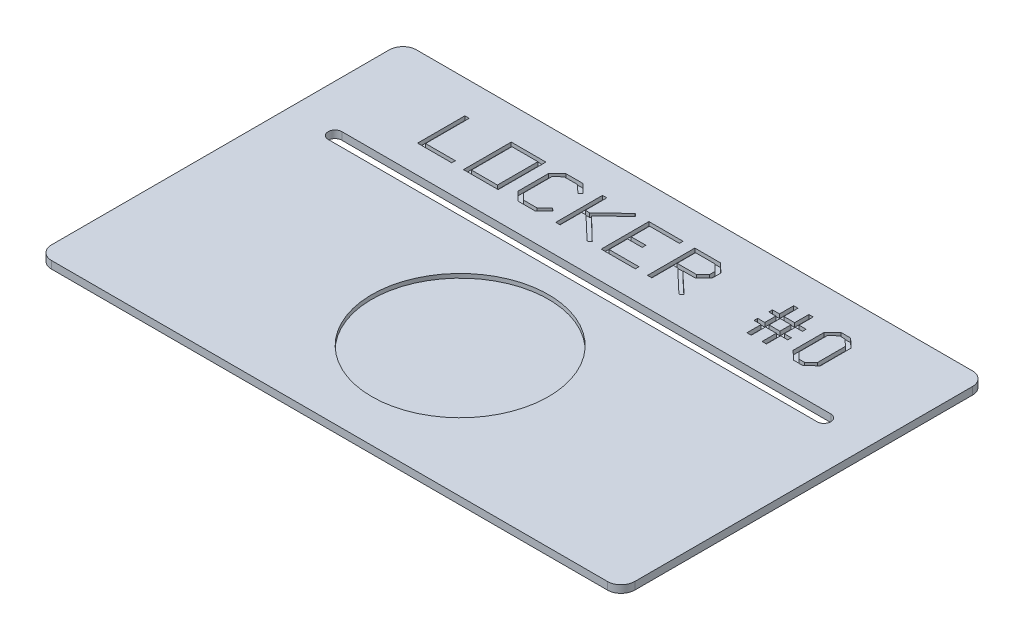
from build123d import *

# Parameters (mm, degrees)
EXTRUDE_1_DEPTH     = 1.1
SKETCH_4_R          = 12.96
SKETCH_4_W          = 5.084081154
SKETCH_4_H          = 7
SKETCH_4_W_2        = 3.808622708
SKETCH_4_H_2        = 5.930745221
SKETCH_4_W_3        = 1.586812329
SKETCH_4_H_3        = 1.62095201
CUT_EXTRUDE_8_DEPTH = 0.6
CUT_EXTRUDE_9_DEPTH = 51.441401646


with BuildPart() as part:
    # Эскиз1 → Бобышка-Вытянуть1 (new body)
    with BuildSketch(Plane(origin=(0, 0, 0), x_dir=(1, 0, 0), z_dir=(0, 1, 0))):
        with BuildLine():
            Line((-40.75, 26.75), (40.75, 26.75))
            ThreePointArc((40.75, 26.75), (42.164213562, 26.164213562), (42.75, 24.75))
            Line((42.75, 24.75), (42.75, -24.75))
            ThreePointArc((42.75, -24.75), (42.164213562, -26.164213562), (40.75, -26.75))
            Line((40.75, -26.75), (-40.75, -26.75))
            ThreePointArc((-40.75, -26.75), (-42.164213562, -26.164213562), (-42.75, -24.75))
            Line((-42.75, -24.75), (-42.75, 24.75))
            ThreePointArc((-42.75, 24.75), (-42.164213562, 26.164213562), (-40.75, 26.75))
        make_face()
    extrude(amount=EXTRUDE_1_DEPTH)

    # Эскиз4 → Вырез-Вытянуть8 (cut)
    # profile 1 of 9: a face of its own
    with BuildSketch(Plane(origin=(0, 1.1, 0), x_dir=(1, 0, 0), z_dir=(0, 1, 0))):
        with Locations(Location((0, -7.603080064, 0), (0, 0, 270))):
            Circle(SKETCH_4_R)
    # profile 2 of 9: a face of its own
    with BuildSketch(Plane(origin=(0, 1.1, 0), x_dir=(1, 0, 0), z_dir=(0, 1, 0))):
        Polygon((-23.824034335, 14.987763796), (-28.831642606, 14.987763796), (-28.831642606, 21.915387674), (-28.193913383, 21.915387674), (-28.193913383, 15.520342805), (-23.824034335, 15.520342805), align=None)
    # profile 3 of 9: a face of its own
    with BuildSketch(Plane(origin=(0, 1.1, 0), x_dir=(1, 0, 0), z_dir=(0, 1, 0))):
        with Locations((-19.559988295, 18.487763796)):
            Rectangle(SKETCH_4_W, SKETCH_4_H)
        with Locations((-19.559988295, 18.485715415)):
            Rectangle(SKETCH_4_W_2, SKETCH_4_H_2, mode=Mode.SUBTRACT)
    # profile 4 of 9: a face of its own
    with BuildSketch(Plane(origin=(0, 1.1, 0), x_dir=(1, 0, 0), z_dir=(0, 1, 0))):
        Polygon((-10.265119001, 16.274146941), (-11.591104175, 14.987763796), (-14.095591104, 14.987763796), (-15.372415139, 16.215426691), (-15.372415139, 20.747810616), (-14.094225517, 21.987763796), (-11.593835349, 21.987763796), (-10.265119001, 20.691821541), (-10.677526336, 20.347693566), (-11.875146313, 21.451088026), (-13.819742489, 21.451088026), (-14.734685915, 20.562090757), (-14.734685915, 16.405243312), (-13.819742489, 15.520342805), (-11.872415139, 15.520342805), (-10.677526336, 16.618274916), align=None)
    # profile 5 of 9: a face of its own
    with BuildSketch(Plane(origin=(0, 1.1, 0), x_dir=(1, 0, 0), z_dir=(0, 1, 0))):
        Polygon((-3.535505267, 15.305945614), (-3.947912602, 14.960452052), (-7.36597737, 18.213280768), (-8.005072181, 18.213280768), (-8.005072181, 15.056043156), (-8.642801405, 15.056043156), (-8.642801405, 21.915387674), (-8.005072181, 21.915387674), (-8.005072181, 18.754053301), (-7.363246196, 18.754053301), (-3.947912602, 22.01507554), (-3.535505267, 21.664119629), (-6.823839251, 18.485032622), align=None)
    # profile 6 of 9: a face of its own
    with BuildSketch(Plane(origin=(0, 1.1, 0), x_dir=(1, 0, 0), z_dir=(0, 1, 0))):
        Polygon((3.094420601, 14.987763796), (-1.913187671, 14.987763796), (-1.913187671, 21.987763796), (3.094420601, 21.987763796), (3.094420601, 21.451088026), (-1.275458447, 21.451088026), (-1.275458447, 18.754053301), (0.872610222, 18.754053301), (0.872610222, 18.213280768), (-1.275458447, 18.213280768), (-1.275458447, 15.520342805), (3.094420601, 15.520342805), align=None)
    # profile 7 of 9: a face of its own
    with BuildSketch(Plane(origin=(0, 1.1, 0), x_dir=(1, 0, 0), z_dir=(0, 1, 0))):
        Polygon((9.900507218, 19.480545692), (8.595005853, 18.213280768), (6.825204838, 18.213280768), (9.923722201, 15.305945614), (9.511314865, 14.960452052), (6.093250098, 18.213280768), (5.454155287, 18.213280768), (5.454155287, 15.056043156), (4.816426063, 15.056043156), (4.816426063, 21.987763796), (8.593640265, 21.987763796), (9.900507218, 20.719133285), align=None)
        Polygon((9.262777995, 19.671727901), (9.262777995, 20.532047838), (8.312329302, 21.451088026), (5.454155287, 21.451088026), (5.454155287, 18.754053301), (8.316426063, 18.754053301), align=None, mode=Mode.SUBTRACT)
    # profile 8 of 9: a face of its own
    with BuildSketch(Plane(origin=(0, 1.1, 0), x_dir=(1, 0, 0), z_dir=(0, 1, 0))):
        Polygon((23.283261803, 17.141294815), (22.246781116, 17.141294815), (22.246781116, 15.056043156), (21.609051892, 15.056043156), (21.609051892, 17.141294815), (20.022239563, 17.141294815), (20.022239563, 15.056043156), (19.388607101, 15.056043156), (19.388607101, 17.141294815), (18.348029653, 17.141294815), (18.348029653, 17.672508236), (19.388607101, 17.672508236), (19.388607101, 19.293460246), (18.348029653, 19.293460246), (18.348029653, 19.835598365), (19.388607101, 19.835598365), (19.388607101, 21.915387674), (20.022239563, 21.915387674), (20.022239563, 19.835598365), (21.609051892, 19.835598365), (21.609051892, 21.915387674), (22.246781116, 21.915387674), (22.246781116, 19.835598365), (23.283261803, 19.835598365), (23.283261803, 19.293460246), (22.246781116, 19.293460246), (22.246781116, 17.672508236), (23.283261803, 17.672508236), align=None)
        with Locations((20.815645728, 18.482984241)):
            Rectangle(SKETCH_4_W_3, SKETCH_4_H_3, mode=Mode.SUBTRACT)
    # profile 9 of 9: a face of its own
    with BuildSketch(Plane(origin=(0, 1.1, 0), x_dir=(1, 0, 0), z_dir=(0, 1, 0))):
        Polygon((28.97639485, 16.244104022), (27.673624659, 14.987763796), (26.282091299, 14.987763796), (25.005267265, 16.215426691), (25.005267265, 20.747810616), (26.283456886, 21.987763796), (27.669527897, 21.987763796), (28.97639485, 20.719133285), align=None)
        Polygon((28.338665626, 16.432555056), (28.338665626, 20.533413426), (27.395044869, 21.451088026), (26.557939914, 21.451088026), (25.642996488, 20.562090757), (25.642996488, 16.405243312), (26.557939914, 15.520342805), (27.397776044, 15.520342805), align=None, mode=Mode.SUBTRACT)
    extrude(amount=-CUT_EXTRUDE_8_DEPTH, mode=Mode.SUBTRACT)

    # Эскиз5 → Вырез-Вытянуть9 (cut, through all)
    with BuildSketch(Plane(origin=(0, 1.1, 0), x_dir=(1, 0, 0), z_dir=(0, 1, 0))):
        with BuildLine():
            Line((-35.845264221, 10.897827852), (35.845264221, 10.897827852))
            ThreePointArc((35.845264221, 10.897827852), (36.845264221, 9.897827852), (35.845264221, 8.897827852))
            Line((35.845264221, 8.897827852), (-35.845264221, 8.897827852))
            ThreePointArc((-35.845264221, 8.897827852), (-36.845264221, 9.897827852), (-35.845264221, 10.897827852))
        make_face()
    extrude(amount=-CUT_EXTRUDE_9_DEPTH, mode=Mode.SUBTRACT)


solid = part.part
